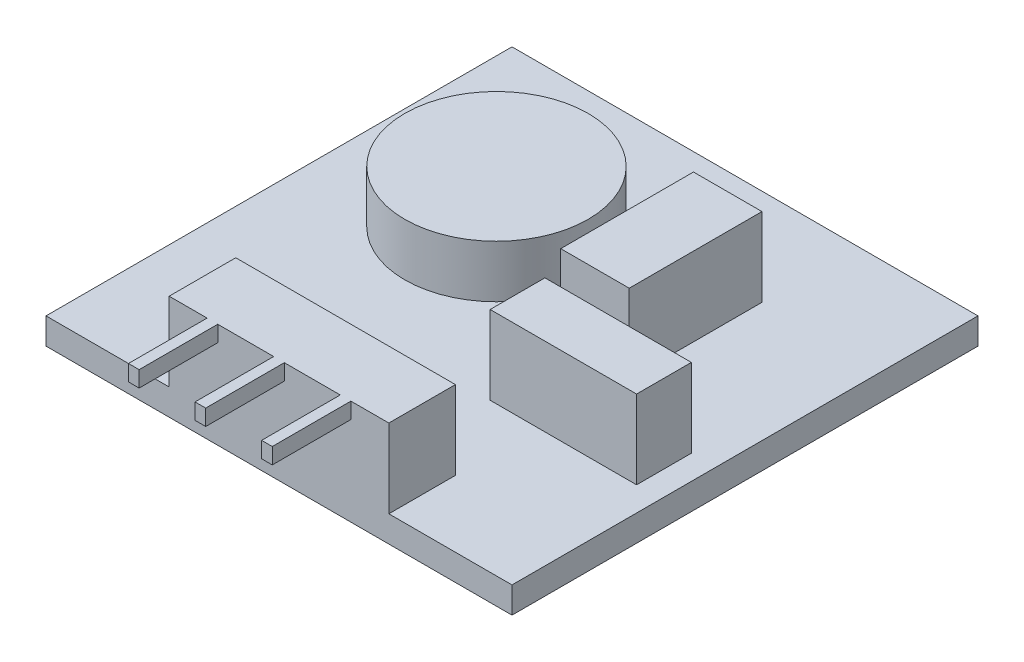
from build123d import *

# Parameters (mm, degrees)
SKETCH1_W           = 17.78
SKETCH1_H           = 17.78
BOSS_EXTRUDE1_DEPTH = 1
SKETCH2_R           = 3.5
BOSS_EXTRUDE2_DEPTH = 2
SKETCH3_W           = 5.587821929
SKETCH3_H           = 2.090408203
SKETCH3_W_2         = 2.613010254
SKETCH3_H_2         = 5.065219877
BOSS_EXTRUDE3_DEPTH = 3
SKETCH4_W           = 8.382
SKETCH4_H           = 2.54
BOSS_EXTRUDE4_DEPTH = 3
SKETCH5_W           = 0.4064
SKETCH5_H           = 0.6096
BOSS_EXTRUDE5_DEPTH = 3


with BuildPart() as part:
    # Sketch1 → Boss-Extrude1 (new body)
    with BuildSketch(Plane(origin=(0, 0, 0), x_dir=(1, 0, 0), z_dir=(0, 1, 0))):
        Rectangle(SKETCH1_W, SKETCH1_H)
    extrude(amount=BOSS_EXTRUDE1_DEPTH)

    # Sketch2 → Boss-Extrude2 (add)
    with BuildSketch(Plane(origin=(0, 1, 0), x_dir=(1, 0, 0), z_dir=(0, 1, 0))):
        with Locations(Location((-3.2361127, 2.643160373, 0), (0, 0, 90))):
            Circle(SKETCH2_R)
    extrude(amount=BOSS_EXTRUDE2_DEPTH)

    # Sketch3 → Boss-Extrude3 (add)
    with BuildSketch(Plane(origin=(0, 1, 0), x_dir=(1, 0, 0), z_dir=(0, 1, 0))):
        with Locations((5.165720273, -2.16075848)):
            Rectangle(SKETCH3_W, SKETCH3_H)
        with Locations((3.015011832, 2.68336053)):
            Rectangle(SKETCH3_W_2, SKETCH3_H_2)
    extrude(amount=BOSS_EXTRUDE3_DEPTH)

    # Sketch4 → Boss-Extrude4 (add)
    with BuildSketch(Plane(origin=(0, 1, 0), x_dir=(1, 0, 0), z_dir=(0, 1, 0))):
        with Locations((0, -7.62)):
            Rectangle(SKETCH4_W, SKETCH4_H)
    extrude(amount=BOSS_EXTRUDE4_DEPTH)

    # Sketch5 → Boss-Extrude5 (add)
    with BuildSketch(Plane.XY.offset(8.89)):
        with Locations((-2.54, 3.6952)):
            Rectangle(SKETCH5_W, SKETCH5_H)
        with Locations((0, 3.6952)):
            Rectangle(SKETCH5_W, SKETCH5_H)
        with Locations((2.54, 3.6952)):
            Rectangle(SKETCH5_W, SKETCH5_H)
    extrude(amount=BOSS_EXTRUDE5_DEPTH)


solid = part.part
